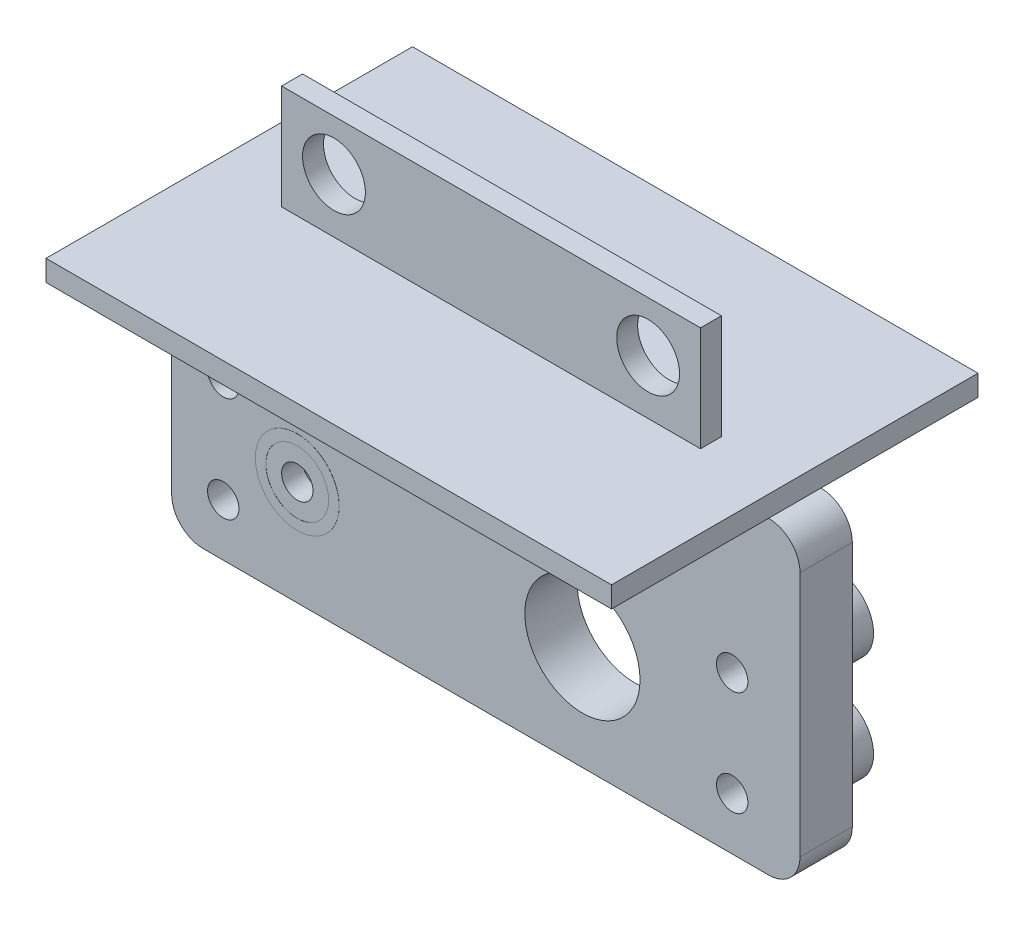
from build123d import *
from build123d.topology import SkipClean

# Parameters (mm, degrees)
SKETCH_1_R          = 1.5
SKETCH_1_R_2        = 5.5
EXTRUDE_1_DEPTH     = 5
SKETCH_3_R          = 4
SKETCH_3_R_2        = 3
EXTRUDE_1_2_DEPTH   = 0.01
SKETCH_7_W          = 54
SKETCH_7_H          = 35
EXTRUDE_2_DEPTH     = 2
EXTRUDE_START       = 5
SKETCH_8_R          = 3.5
SKETCH_8_R_2        = 1.5
EXTRUDE_2_2_DEPTH   = 5
SKETCH_10_W         = 40
SKETCH_10_H         = 10
SKETCH_10_R         = 3
EXTRUDE_3_DEPTH     = 2
SKETCH_11_R         = 1.5
CUT_EXTRUDE_1_DEPTH = 10
SKETCH_12_R         = 2.75
CUT_EXTRUDE_2_DEPTH = 3


with BuildPart() as part:
    # 草图1 → Extrude 1 (new body)
    with BuildSketch(Plane.XY):
        with BuildLine():
            Line((-15.5, 19.5), (38.5, 19.5))
            ThreePointArc((38.5, 19.5), (40.621320344, 18.621320344), (41.5, 16.5))
            Line((41.5, 16.5), (41.5, -7))
            ThreePointArc((41.5, -7), (40.621320344, -9.121320344), (38.5, -10))
            Line((38.5, -10), (33.3, -10))
            Line((33.3, -10), (30.825, -10))
            Line((30.825, -10), (-9.175, -10))
            Line((-9.175, -10), (-15.5, -10))
            ThreePointArc((-15.5, -10), (-17.621320344, -9.121320344), (-18.5, -7))
            Line((-18.5, -7), (-18.5, 16.5))
            ThreePointArc((-18.5, 16.5), (-17.621320344, 18.621320344), (-15.5, 19.5))
        make_face()
        with Locations((-13.575, 5)):
            Circle(SKETCH_1_R, mode=Mode.SUBTRACT)
        with Locations((-13.575, -5)):
            Circle(SKETCH_1_R, mode=Mode.SUBTRACT)
        with Locations((35.025, 5)):
            Circle(SKETCH_1_R, mode=Mode.SUBTRACT)
        with Locations((35.025, -5)):
            Circle(SKETCH_1_R, mode=Mode.SUBTRACT)
        with Locations((20.725, 0)):
            Circle(SKETCH_1_R_2, mode=Mode.SUBTRACT)
    extrude(amount=EXTRUDE_1_DEPTH)

    # 草图3 → Extrude 1 2 (add)
    with BuildSketch(Plane.XY.offset(5)):
        with Locations((-6.5, 0)):
            Circle(SKETCH_3_R)
        with Locations((-6.5, 0)):
            Circle(SKETCH_3_R_2, mode=Mode.SUBTRACT)
    extrude(amount=EXTRUDE_1_2_DEPTH)

    # 草图7 → Extrude 2 (add)
    with BuildSketch(Plane(origin=(0, 19.5, 0), x_dir=(1, 0, 0), z_dir=(0, 1, 0))):
        with Locations((11.5, -2.5)):
            Rectangle(SKETCH_7_W, SKETCH_7_H)
    extrude(amount=EXTRUDE_2_DEPTH)

    # 草图8 → Extrude 2 2 (add)
    # profile 1 of 4: a face of its own
    with SkipClean():  # the faces are left unmerged after this step: merging them gives an invalid solid
        with BuildSketch(Plane(origin=(0, 0, 0), x_dir=(-1, 0, 0), z_dir=(0, 0, -1)).offset(EXTRUDE_START)):
            with Locations((-35.025, 5)):
                Circle(SKETCH_8_R)
            with Locations((-35.025, 5)):
                Circle(SKETCH_8_R_2, mode=Mode.SUBTRACT)
        # profile 2 of 4: a face of its own
        with BuildSketch(Plane(origin=(0, 0, 0), x_dir=(-1, 0, 0), z_dir=(0, 0, -1)).offset(EXTRUDE_START)):
            with Locations((-35.025, -5)):
                Circle(SKETCH_8_R)
            with Locations((-35.025, -5)):
                Circle(SKETCH_8_R_2, mode=Mode.SUBTRACT)
        # profile 3 of 4: a face of its own
        with BuildSketch(Plane(origin=(0, 0, 0), x_dir=(-1, 0, 0), z_dir=(0, 0, -1)).offset(EXTRUDE_START)):
            with Locations((13.575, 5)):
                Circle(SKETCH_8_R)
            with Locations((13.575, 5)):
                Circle(SKETCH_8_R_2, mode=Mode.SUBTRACT)
        # profile 4 of 4: a face of its own
        with BuildSketch(Plane(origin=(0, 0, 0), x_dir=(-1, 0, 0), z_dir=(0, 0, -1)).offset(EXTRUDE_START)):
            with Locations((13.575, -5)):
                Circle(SKETCH_8_R)
            with Locations((13.575, -5)):
                Circle(SKETCH_8_R_2, mode=Mode.SUBTRACT)
        extrude(amount=-EXTRUDE_2_2_DEPTH)

    # 草图10 → 凸台-拉伸3 (add)
    with SkipClean():  # the faces are left unmerged after this step: merging them gives an invalid solid
        with BuildSketch(Plane.XY.offset(2.5)):
            with Locations((11.5, 26.5)):
                Rectangle(SKETCH_10_W, SKETCH_10_H)
            with Locations((26.5, 26.7)):
                Circle(SKETCH_10_R, mode=Mode.SUBTRACT)
            with Locations(Location((-3.5, 26.7, 0), (0, 0, 180))):
                Circle(SKETCH_10_R, mode=Mode.SUBTRACT)
        extrude(amount=EXTRUDE_3_DEPTH)

    # 草图11 → 切除-拉伸1 (cut)
    with SkipClean():  # the faces are left unmerged after this step: merging them gives an invalid solid
        with BuildSketch(Plane.XY.offset(5)):
            with Locations((-6.5, 0)):
                Circle(SKETCH_11_R)
        extrude(amount=-CUT_EXTRUDE_1_DEPTH, mode=Mode.SUBTRACT)

    # 草图12 → 切除-拉伸2 (cut)
    with SkipClean():  # the faces are left unmerged after this step: merging them gives an invalid solid
        with BuildSketch(Plane(origin=(0, 0, 0), x_dir=(-1, 0, 0), z_dir=(0, 0, -1))):
            with Locations((6.5, 0)):
                Circle(SKETCH_12_R)
        extrude(amount=-CUT_EXTRUDE_2_DEPTH, mode=Mode.SUBTRACT)


solid = part.part
